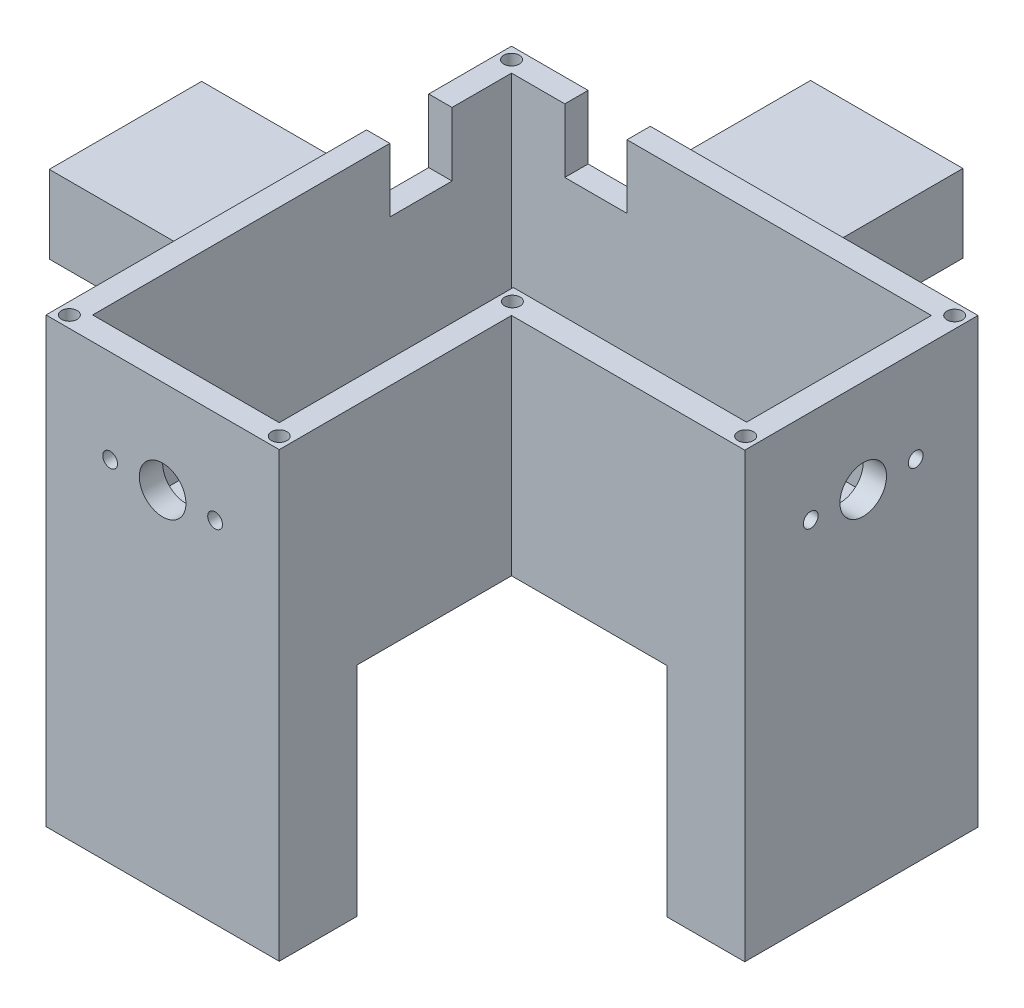
from build123d import *

# Parameters (mm, degrees)
ESQUISSE1_W              = 36.06
ESQUISSE1_H              = 19.6
ESQUISSE1_W_2            = 3
ESQUISSE1_H_2            = 3
ESQUISSE1_W_3            = 19.6
ESQUISSE1_H_3            = 24.34
ESQUISSE1_W_4            = 25.26
ESQUISSE1_H_4            = 36.26
BOSS_EXTRU_1_DEPTH       = 29.8
ESQUISSE2_W              = 19.6
ESQUISSE2_H              = 43.94
ESQUISSE2_W_2            = 25.26
ESQUISSE2_H_2            = 19.6
ENL_V_MAT_EXTRU_1_DEPTH  = 24.8
ESQUISSE3_W              = 36.06
ESQUISSE3_H              = 19.6
ESQUISSE3_W_2            = 19.6
ESQUISSE3_H_2            = 36.26
ENL_V_MAT_EXTRU_2_DEPTH  = 19.8
ESQUISSE6_W              = 56.587695841
ESQUISSE6_H              = 55.109837561
ENL_V_MAT_EXTRU_5_DEPTH  = 5
ESQUISSE7_W              = 4
ESQUISSE7_H              = 4
ENL_V_MAT_EXTRU_6_DEPTH  = 5
ESQUISSE8_W              = 4
ESQUISSE8_H              = 4
ENL_V_MAT_EXTRU_7_DEPTH  = 5
ENL_V_MAT_EXTRU_9_DEPTH  = 5
ENL_V_MAT_EXTRU_10_DEPTH = 5
ESQUISSE20_W             = 25.6
ESQUISSE20_H             = 10
BOSS_EXTRU_4_DEPTH       = 30.13
ESQUISSE21_W             = 10
ESQUISSE21_H             = 25.6
BOSS_EXTRU_5_DEPTH       = 30.13
ESQUISSE22_R             = 1.5
ENL_V_MAT_EXTRU_17_DEPTH = 5
ESQUISSE23_W             = 8
ESQUISSE23_H             = 10.8
BOSS_EXTRU_9_DEPTH       = 2.2
ESQUISSE28_W             = 10
ESQUISSE28_H             = 30.13
BOSS_EXTRU_10_DEPTH      = 2.2
ESQUISSE29_W             = 10
ESQUISSE29_H             = 30.13
BOSS_EXTRU_11_DEPTH      = 2.2
ESQUISSE30_W             = 3
ESQUISSE30_H             = 10
ESQUISSE30_W_2           = 8
ESQUISSE30_H_2           = 10.8
ESQUISSE30_W_3           = 10
ESQUISSE30_H_3           = 30.13
BOSS_EXTRU_12_DEPTH      = 2.2
ESQUISSE31_W             = 24.34
ESQUISSE31_H             = 19.8
ENL_V_MAT_EXTRU_18_DEPTH = 2.2
ESQUISSE32_W             = 23.06
ESQUISSE32_H             = 19.8
ENL_V_MAT_EXTRU_19_DEPTH = 2.2
ESQUISSE33_W             = 44.86
ESQUISSE33_H             = 19.8
ENL_V_MAT_EXTRU_20_DEPTH = 2.2
ESQUISSE34_W             = 46.14
ESQUISSE34_H             = 19.8
ENL_V_MAT_EXTRU_21_DEPTH = 2.2
ESQUISSE36_W             = 30
ESQUISSE36_H             = 54.93
BOSS_EXTRU_13_DEPTH      = 8.09
ESQUISSE37_W             = 30
ESQUISSE37_H             = 54.93
BOSS_EXTRU_14_DEPTH      = 8.09
ESQUISSE38_W             = 24
ESQUISSE38_H             = 19.8
ENL_V_MAT_EXTRU_24_DEPTH = 8.09
ESQUISSE39_W             = 24
ESQUISSE39_H             = 19.8
ENL_V_MAT_EXTRU_25_DEPTH = 8.09
ESQUISSE40_W             = 30
ESQUISSE40_H             = 30.13
ENL_V_MAT_EXTRU_26_DEPTH = 8.09
ESQUISSE41_W             = 30
ESQUISSE41_H             = 30.13
ENL_V_MAT_EXTRU_27_DEPTH = 8.09
ESQUISSE42_W             = 5.2
ESQUISSE42_H             = 10
BOSS_EXTRU_15_DEPTH      = 2.2
ESQUISSE43_W             = 3
ESQUISSE43_H             = 11
ESQUISSE43_W_2           = 8
ESQUISSE43_H_2           = 3
ESQUISSE43_W_3           = 39.15
ESQUISSE43_W_4           = 27.068190365
ESQUISSE43_H_3           = 2.93851698
ESQUISSE43_H_4           = 38.23
BOSS_EXTRU_16_DEPTH      = 4.2
ESQUISSE46_W             = 20.80469935
ESQUISSE46_H             = 8.510340819
BOSS_EXTRU_17_DEPTH      = 3
ESQUISSE47_W             = 0.068190365
ESQUISSE47_H             = 30.23
BOSS_EXTRU_18_DEPTH      = 4.2
ESQUISSE49_W             = 64.620174687
ESQUISSE49_H             = 80.514043406
ENL_V_MAT_EXTRU_30_DEPTH = 2.13
ESQUISSE50_W             = 10
ESQUISSE50_H             = 28
BOSS_EXTRU_19_DEPTH      = 1.15
ESQUISSE51_W             = 30.23
ESQUISSE51_H             = 24
ENL_V_MAT_EXTRU_31_DEPTH = 1.15
ESQUISSE52_W             = 38.23
ESQUISSE52_H             = 8.2
BOSS_EXTRU_20_DEPTH      = 1.15
ESQUISSE53_W             = 5.8
ESQUISSE53_H             = 8.2
ESQUISSE53_W_2           = 41.23
ESQUISSE53_W_3           = 10
ESQUISSE53_H_2           = 28
ENL_V_MAT_EXTRU_32_DEPTH = 1.15
ESQUISSE54_W             = 10
ESQUISSE54_H             = 28
BOSS_EXTRU_21_DEPTH      = 0.23
ESQUISSE55_W             = 39.15
ESQUISSE55_H             = 8.2
BOSS_EXTRU_22_DEPTH      = 0.23
ESQUISSE56_W             = 26.35
ESQUISSE56_H             = 10
ESQUISSE56_W_2           = 5.8
ESQUISSE56_H_2           = 8.2
ESQUISSE56_W_3           = 9.85
ESQUISSE56_W_4           = 4.05
ENL_V_MAT_EXTRU_33_DEPTH = 0.23
ESQUISSE57_R             = 3
ESQUISSE57_R_2           = 0.95
ENL_V_MAT_EXTRU_34_DEPTH = 7.23
ESQUISSE58_R             = 3
ESQUISSE58_R_2           = 0.95
ENL_V_MAT_EXTRU_35_DEPTH = 7.23
ESQUISSE59_W             = 10
ESQUISSE59_H             = 28
BOSS_EXTRU_23_DEPTH      = 0.12
ESQUISSE60_W             = 8
ESQUISSE60_H             = 15.8
BOSS_EXTRU_24_DEPTH      = 0.12
ESQUISSE61_W             = 32.15
ESQUISSE61_H             = 8.2
ESQUISSE61_W_2           = 26.35
ESQUISSE61_H_2           = 10
ESQUISSE61_W_3           = 9.85
ESQUISSE61_W_4           = 4.05
ENL_V_MAT_EXTRU_36_DEPTH = 0.12
ESQUISSE62_W             = 30
ESQUISSE62_H             = 24
ENL_V_MAT_EXTRU_37_DEPTH = 0.12
ENL_V_MAT_EXTRU_38_DEPTH = 5


with BuildPart() as part:
    # Esquisse1 → Boss.-Extru.1 (new body)
    with BuildSketch(Plane(origin=(0, 0, 0), x_dir=(1, 0, 0), z_dir=(0, 1, 0))):
        with Locations((-65.89, 9.8)):
            Rectangle(ESQUISSE1_W, ESQUISSE1_H)
        with Locations((-46.36, 9.8)):
            Rectangle(ESQUISSE1_W_2, ESQUISSE1_H)
        with Locations((-46.36, 21.1)):
            Rectangle(ESQUISSE1_W_2, ESQUISSE1_H_2)
        with Locations((-35.06, 21.1)):
            Rectangle(ESQUISSE1_W_3, ESQUISSE1_H_2)
        Polygon((0, 19.6), (0, 0), (-25.26, 0), (-25.26, -24.34), (-44.86, -24.34), (-44.86, 0), (-47.86, 0), (-47.86, -27.34), (-22.26, -27.34), (-22.26, -3), (3, -3), (3, 22.6), (-25.26, 22.6), (-25.26, 19.6), align=None)
        with Locations((-35.06, 9.8)):
            Rectangle(ESQUISSE1_W_3, ESQUISSE1_H)
        with Locations((-35.06, -12.17)):
            Rectangle(ESQUISSE1_W_3, ESQUISSE1_H_3)
        with Locations((-12.63, 9.8)):
            Rectangle(ESQUISSE1_W_4, ESQUISSE1_H)
        with Locations((-35.06, 40.73)):
            Rectangle(ESQUISSE1_W_3, ESQUISSE1_H_4)
    extrude(amount=BOSS_EXTRU_1_DEPTH)

    # Esquisse2 → Enlèv. mat.-Extru.1 (cut)
    with BuildSketch(Plane(origin=(0, 29.8, 0), x_dir=(1, 0, 0), z_dir=(0, 1, 0))):
        with Locations((-35.06, -2.37)):
            Rectangle(ESQUISSE2_W, ESQUISSE2_H)
        with Locations((-12.63, 9.8)):
            Rectangle(ESQUISSE2_W_2, ESQUISSE2_H_2)
    extrude(amount=-ENL_V_MAT_EXTRU_1_DEPTH, mode=Mode.SUBTRACT)

    # Esquisse3 → Enlèv. mat.-Extru.2 (cut)
    with BuildSketch(Plane(origin=(0, 29.8, 0), x_dir=(1, 0, 0), z_dir=(0, 1, 0))):
        with Locations((-65.89, 9.8)):
            Rectangle(ESQUISSE3_W, ESQUISSE3_H)
        with Locations((-35.06, 40.73)):
            Rectangle(ESQUISSE3_W_2, ESQUISSE3_H_2)
    extrude(amount=-ENL_V_MAT_EXTRU_2_DEPTH, mode=Mode.SUBTRACT)

    # Esquisse6 → Enlèv. mat.-Extru.5 (cut)
    with BuildSketch(Plane(origin=(-47.86, 29.8, 27.34), x_dir=(1, 0, 0), z_dir=(0, -1, 0))):
        with Locations((28.293847921, -22.38508122)):
            Rectangle(ESQUISSE6_W, ESQUISSE6_H)
    extrude(amount=ENL_V_MAT_EXTRU_5_DEPTH, mode=Mode.SUBTRACT)

    # Esquisse7 → Enlèv. mat.-Extru.6 (cut)
    with BuildSketch(Plane.ZY.offset(47.86)):
        with Locations((-11.8, 22.8)):
            Rectangle(ESQUISSE7_W, ESQUISSE7_H)
        with Locations((-7.8, 22.8)):
            Rectangle(ESQUISSE7_W, ESQUISSE7_H)
    extrude(amount=-ENL_V_MAT_EXTRU_6_DEPTH, mode=Mode.SUBTRACT)

    # Esquisse8 → Enlèv. mat.-Extru.7 (cut)
    with BuildSketch(Plane(origin=(0, 0, -22.6), x_dir=(-1, 0, 0), z_dir=(0, 0, -1))):
        with Locations((37.06, 22.8)):
            Rectangle(ESQUISSE8_W, ESQUISSE8_H)
        with Locations((33.06, 22.8)):
            Rectangle(ESQUISSE8_W, ESQUISSE8_H)
    extrude(amount=-ENL_V_MAT_EXTRU_7_DEPTH, mode=Mode.SUBTRACT)

    # Esquisse10 → Enlèv. mat.-Extru.9 (cut)
    with BuildSketch(Plane.ZY.offset(83.92)):
        with BuildLine():
            ThreePointArc((-3.4, 5), (-4.318983352, 6.38290262), (-5.949892874, 6.071319259))
            Line((-5.949892874, 6.071319259), (-3.850107126, 3.928680741))
            ThreePointArc((-3.850107126, 3.928680741), (-3.51709738, 4.418983352), (-3.4, 5))
        make_face()
        with BuildLine():
            Line((-3.850107126, 3.928680741), (-5.949892874, 6.071319259))
            ThreePointArc((-5.949892874, 6.071319259), (-5.971319259, 3.950107126), (-3.850107126, 3.928680741))
        make_face()
        with BuildLine():
            ThreePointArc((-13.2, 5), (-13.31709738, 5.581016648), (-13.650107126, 6.071319259))
            Line((-13.650107126, 6.071319259), (-15.749892874, 3.928680741))
            ThreePointArc((-15.749892874, 3.928680741), (-14.118983352, 3.61709738), (-13.2, 5))
        make_face()
        with BuildLine():
            Line((-15.749892874, 3.928680741), (-13.650107126, 6.071319259))
            ThreePointArc((-13.650107126, 6.071319259), (-15.771319259, 6.049892874), (-15.749892874, 3.928680741))
        make_face()
    extrude(amount=-ENL_V_MAT_EXTRU_9_DEPTH, mode=Mode.SUBTRACT)

    # Esquisse11 → Enlèv. mat.-Extru.10 (cut)
    with BuildSketch(Plane(origin=(0, 0, -58.86), x_dir=(-1, 0, 0), z_dir=(0, 0, -1))):
        with BuildLine():
            ThreePointArc((31.66, 5), (30.741016648, 6.38290262), (29.110107126, 6.071319259))
            Line((29.110107126, 6.071319259), (31.209892874, 3.928680741))
            ThreePointArc((31.209892874, 3.928680741), (31.54290262, 4.418983352), (31.66, 5))
        make_face()
        with BuildLine():
            Line((31.209892874, 3.928680741), (29.110107126, 6.071319259))
            ThreePointArc((29.110107126, 6.071319259), (29.088680741, 3.950107126), (31.209892874, 3.928680741))
        make_face()
        with BuildLine():
            ThreePointArc((41.009892874, 6.071319259), (38.888680741, 6.049892874), (38.910107126, 3.928680741))
            Line((38.910107126, 3.928680741), (41.009892874, 6.071319259))
        make_face()
        with BuildLine():
            Line((41.009892874, 6.071319259), (38.910107126, 3.928680741))
            ThreePointArc((38.910107126, 3.928680741), (40.541016648, 3.61709738), (41.46, 5))
            ThreePointArc((41.46, 5), (41.34290262, 5.581016648), (41.009892874, 6.071319259))
        make_face()
    extrude(amount=-ENL_V_MAT_EXTRU_10_DEPTH, mode=Mode.SUBTRACT)

    # Esquisse20 → Boss.-Extru.4 (add)
    with BuildSketch(Plane.XZ):
        with Locations((-35.06, 22.34)):
            Rectangle(ESQUISSE20_W, ESQUISSE20_H)
    extrude(amount=BOSS_EXTRU_4_DEPTH)

    # Esquisse21 → Boss.-Extru.5 (add)
    with BuildSketch(Plane.XZ):
        with Locations((-2, -9.8)):
            Rectangle(ESQUISSE21_W, ESQUISSE21_H)
    extrude(amount=BOSS_EXTRU_5_DEPTH)

    # Esquisse22 → Enlèv. mat.-Extru.17 (cut)
    with BuildSketch(Plane.XZ.offset(30.13)):
        with BuildLine():
            ThreePointArc((-2.923466063, -2.217963439), (-3.182036561, -4.323466063), (-1.076533937, -4.582036561))
            Line((-1.076533937, -4.582036561), (-2.923466063, -2.217963439))
        make_face()
        with BuildLine():
            Line((-2.923466063, -2.217963439), (-1.076533937, -4.582036561))
            ThreePointArc((-1.076533937, -4.582036561), (-0.651816204, -4.057571633), (-0.5, -3.4))
            ThreePointArc((-0.5, -3.4), (-1.342428367, -2.051816204), (-2.923466063, -2.217963439))
        make_face()
        with BuildLine():
            ThreePointArc((-27.16, 22.34), (-28.171663457, 23.758283265), (-29.842036561, 23.263466063))
            Line((-29.842036561, 23.263466063), (-27.477963439, 21.416533937))
            ThreePointArc((-27.477963439, 21.416533937), (-27.241716735, 21.851663457), (-27.16, 22.34))
        make_face()
        with BuildLine():
            Line((-27.477963439, 21.416533937), (-29.842036561, 23.263466063))
            ThreePointArc((-29.842036561, 23.263466063), (-29.583466063, 21.157963439), (-27.477963439, 21.416533937))
        make_face()
        with BuildLine():
            ThreePointArc((-39.96, 22.34), (-40.041716735, 22.828336543), (-40.277963439, 23.263466063))
            Line((-40.277963439, 23.263466063), (-42.642036561, 21.416533937))
            ThreePointArc((-42.642036561, 21.416533937), (-40.971663457, 20.921716735), (-39.96, 22.34))
        make_face()
        with BuildLine():
            Line((-42.642036561, 21.416533937), (-40.277963439, 23.263466063))
            ThreePointArc((-40.277963439, 23.263466063), (-42.383466063, 23.522036561), (-42.642036561, 21.416533937))
        make_face()
        with Locations(Location((-2, -16.2, 0), (0, 0, 270))):
            Circle(ESQUISSE22_R)
    extrude(amount=-ENL_V_MAT_EXTRU_17_DEPTH, mode=Mode.SUBTRACT)

    # Esquisse23 → Boss.-Extru.9 (add)
    with BuildSketch(Plane(origin=(0, 0, -22.6), x_dir=(-1, 0, 0), z_dir=(0, 0, -1))):
        Polygon((39.06, 20.8), (39.06, 10), (44.86, 10), (47.86, 10), (47.86, 24.8), (39.06, 24.8), align=None)
        with Locations((35.06, 15.4)):
            Rectangle(ESQUISSE23_W, ESQUISSE23_H)
        Polygon((25.26, 24.8), (7, 24.8), (7, 0), (25.26, 0), (25.26, 10), align=None)
        Polygon((31.06, 24.8), (25.26, 24.8), (25.26, 10), (31.06, 10), (31.06, 20.8), align=None)
        Polygon((7, 24.8), (-3, 24.8), (-3, -30.13), (7, -30.13), (7, 0), align=None)
    extrude(amount=BOSS_EXTRU_9_DEPTH)

    # Esquisse28 → Boss.-Extru.10 (add)
    with BuildSketch(Plane.XY.offset(3)):
        Polygon((3, 24.8), (-22.26, 24.8), (-22.26, 0), (-7, 0), (3, 0), align=None)
        with Locations((-2, -15.065)):
            Rectangle(ESQUISSE28_W, ESQUISSE28_H)
    extrude(amount=BOSS_EXTRU_10_DEPTH)

    # Esquisse29 → Boss.-Extru.11 (add)
    with BuildSketch(Plane(origin=(-22.26, 0, 0), x_dir=(0, 0, -1), z_dir=(1, 0, 0))):
        Polygon((-5.2, 24.8), (-27.34, 24.8), (-27.34, 0), (-17.34, 0), (-5.2, 0), align=None)
        with Locations((-22.34, -15.065)):
            Rectangle(ESQUISSE29_W, ESQUISSE29_H)
    extrude(amount=BOSS_EXTRU_11_DEPTH)

    # Esquisse30 → Boss.-Extru.12 (add)
    with BuildSketch(Plane.ZY.offset(47.86)):
        with Locations((-21.1, 5)):
            Rectangle(ESQUISSE30_W, ESQUISSE30_H)
        Polygon((-24.8, 24.8), (-24.8, 10), (-22.6, 10), (-19.6, 10), (-13.8, 10), (-13.8, 20.8), (-13.8, 24.8), align=None)
        with Locations((-9.8, 15.4)):
            Rectangle(ESQUISSE30_W_2, ESQUISSE30_H_2)
        Polygon((-5.8, 20.8), (-5.8, 10), (0, 10), (27.34, 10), (27.34, 24.8), (-5.8, 24.8), align=None)
        Polygon((27.34, 10), (0, 10), (0, 0), (17.34, 0), (27.34, 0), align=None)
        with Locations((22.34, -15.065)):
            Rectangle(ESQUISSE30_W_3, ESQUISSE30_H_3)
    extrude(amount=BOSS_EXTRU_12_DEPTH)

    # Esquisse31 → Enlèv. mat.-Extru.18 (cut)
    with BuildSketch(Plane.ZY.offset(25.26)):
        with Locations((12.17, 14.9)):
            Rectangle(ESQUISSE31_W, ESQUISSE31_H)
    extrude(amount=-ENL_V_MAT_EXTRU_18_DEPTH, mode=Mode.SUBTRACT)

    # Esquisse32 → Enlèv. mat.-Extru.19 (cut)
    with BuildSketch(Plane(origin=(0, 0, 0), x_dir=(-1, 0, 0), z_dir=(0, 0, -1))):
        with Locations((11.53, 14.9)):
            Rectangle(ESQUISSE32_W, ESQUISSE32_H)
    extrude(amount=-ENL_V_MAT_EXTRU_19_DEPTH, mode=Mode.SUBTRACT)

    # Esquisse33 → Enlèv. mat.-Extru.20 (cut)
    with BuildSketch(Plane.XY.offset(-19.6)):
        with Locations((-22.43, 14.9)):
            Rectangle(ESQUISSE33_W, ESQUISSE33_H)
    extrude(amount=-ENL_V_MAT_EXTRU_20_DEPTH, mode=Mode.SUBTRACT)

    # Esquisse34 → Enlèv. mat.-Extru.21 (cut)
    with BuildSketch(Plane(origin=(-44.86, 0, 0), x_dir=(0, 0, -1), z_dir=(1, 0, 0))):
        with Locations((-1.27, 14.9)):
            Rectangle(ESQUISSE34_W, ESQUISSE34_H)
    extrude(amount=-ENL_V_MAT_EXTRU_21_DEPTH, mode=Mode.SUBTRACT)

    # Esquisse36 → Boss.-Extru.13 (add)
    with BuildSketch(Plane.XY.offset(27.34)):
        with Locations((-35.06, -2.665)):
            Rectangle(ESQUISSE36_W, ESQUISSE36_H)
    extrude(amount=BOSS_EXTRU_13_DEPTH)

    # Esquisse37 → Boss.-Extru.14 (add)
    with BuildSketch(Plane(origin=(3, 0, 0), x_dir=(0, 0, -1), z_dir=(1, 0, 0))):
        with Locations((9.8, -2.665)):
            Rectangle(ESQUISSE37_W, ESQUISSE37_H)
    extrude(amount=BOSS_EXTRU_14_DEPTH)

    # Esquisse38 → Enlèv. mat.-Extru.24 (cut)
    with BuildSketch(Plane(origin=(0, 0, 24.34), x_dir=(-1, 0, 0), z_dir=(0, 0, -1))):
        with Locations((35.06, 14.9)):
            Rectangle(ESQUISSE38_W, ESQUISSE38_H)
    extrude(amount=-ENL_V_MAT_EXTRU_24_DEPTH, mode=Mode.SUBTRACT)

    # Esquisse39 → Enlèv. mat.-Extru.25 (cut)
    with BuildSketch(Plane.ZY):
        with Locations((-9.8, 14.9)):
            Rectangle(ESQUISSE39_W, ESQUISSE39_H)
    extrude(amount=-ENL_V_MAT_EXTRU_25_DEPTH, mode=Mode.SUBTRACT)

    # Esquisse40 → Enlèv. mat.-Extru.26 (cut)
    with BuildSketch(Plane.ZY.offset(7)):
        with Locations((-9.8, -15.065)):
            Rectangle(ESQUISSE40_W, ESQUISSE40_H)
    extrude(amount=-ENL_V_MAT_EXTRU_26_DEPTH, mode=Mode.SUBTRACT)

    # Esquisse41 → Enlèv. mat.-Extru.27 (cut)
    with BuildSketch(Plane(origin=(0, 0, 17.34), x_dir=(-1, 0, 0), z_dir=(0, 0, -1))):
        with Locations((35.06, -15.065)):
            Rectangle(ESQUISSE41_W, ESQUISSE41_H)
    extrude(amount=-ENL_V_MAT_EXTRU_27_DEPTH, mode=Mode.SUBTRACT)

    # Esquisse42 → Boss.-Extru.15 (add)
    with BuildSketch(Plane(origin=(0, 0, -22.6), x_dir=(-1, 0, 0), z_dir=(0, 0, -1))):
        with Locations((47.46, 5)):
            Rectangle(ESQUISSE42_W, ESQUISSE42_H)
    extrude(amount=BOSS_EXTRU_15_DEPTH)

    # Esquisse43 → Boss.-Extru.16 (add)
    with BuildSketch(Plane(origin=(0, 24.8, 0), x_dir=(1, 0, 0), z_dir=(0, 1, 0))):
        with Locations((-48.56, 19.3)):
            Rectangle(ESQUISSE43_W, ESQUISSE43_H)
        with Locations((-43.06, 23.3)):
            Rectangle(ESQUISSE43_W_2, ESQUISSE43_H_2)
        with Locations((-11.485, 23.3)):
            Rectangle(ESQUISSE43_W_3, ESQUISSE43_H_2)
        Polygon((11.09, 24.8), (8.09, 24.8), (8.09, 21.8), (8.09, -2.2), (8.09, -5.2), (11.09, -5.2), align=None)
        Polygon((8.09, -5.2), (8.09, -2.2), (-22.991809635, -2.2), (-22.991809635, -5.2), (-20.06, -5.2), align=None)
        Polygon((-20.06, -35.43), (-20.06, -5.2), (-22.991809635, -5.2), (-22.991809635, -32.49148302), (-22.991809635, -35.43), align=None)
        with Locations((-36.525904818, -33.96074151)):
            Rectangle(ESQUISSE43_W_4, ESQUISSE43_H_3)
        with Locations((-48.56, -13.315)):
            Rectangle(ESQUISSE43_W, ESQUISSE43_H_4)
    extrude(amount=BOSS_EXTRU_16_DEPTH)

    # Esquisse46 → Boss.-Extru.17 (add)
    with BuildSketch(Plane.ZY.offset(50.06)):
        with Locations((-9.490469772, 16.17879145)):
            Rectangle(ESQUISSE46_W, ESQUISSE46_H)
    extrude(amount=-BOSS_EXTRU_17_DEPTH)

    # Esquisse47 → Boss.-Extru.18 (add)
    with BuildSketch(Plane(origin=(0, 24.8, 0), x_dir=(1, 0, 0), z_dir=(0, 1, 0))):
        with Locations((-23.025904818, -17.315)):
            Rectangle(ESQUISSE47_W, ESQUISSE47_H)
        Polygon((-47.06, -32.43), (-50.06, -32.43), (-50.06, -32.49148302), (-22.991809635, -32.49148302), (-22.991809635, -32.43), (-23.06, -32.43), align=None)
    extrude(amount=BOSS_EXTRU_18_DEPTH)

    # Esquisse49 → Enlèv. mat.-Extru.30 (cut)
    with BuildSketch(Plane.XZ.offset(30.13)):
        with Locations((-17.749912657, -4.827021703)):
            Rectangle(ESQUISSE49_W, ESQUISSE49_H)
    extrude(amount=-ENL_V_MAT_EXTRU_30_DEPTH, mode=Mode.SUBTRACT)

    # Esquisse50 → Boss.-Extru.19 (add)
    with BuildSketch(Plane(origin=(-20.06, 0, 0), x_dir=(0, 0, -1), z_dir=(1, 0, 0))):
        Polygon((-5.2, 29), (-35.43, 29), (-35.43, 0), (-25.43, 0), (-5.2, 0), align=None)
        with Locations((-30.43, -14)):
            Rectangle(ESQUISSE50_W, ESQUISSE50_H)
    extrude(amount=BOSS_EXTRU_19_DEPTH)

    # Esquisse51 → Enlèv. mat.-Extru.31 (cut)
    with BuildSketch(Plane.ZY.offset(23.06)):
        with Locations((17.315, 17)):
            Rectangle(ESQUISSE51_W, ESQUISSE51_H)
    extrude(amount=-ENL_V_MAT_EXTRU_31_DEPTH, mode=Mode.SUBTRACT)

    # Esquisse52 → Boss.-Extru.20 (add)
    with BuildSketch(Plane(origin=(-47.06, 0, 0), x_dir=(0, 0, -1), z_dir=(1, 0, 0))):
        with Locations((-13.315, 24.9)):
            Rectangle(ESQUISSE52_W, ESQUISSE52_H)
        Polygon((5.8, 20.8), (-32.43, 20.8), (-32.43, 5), (13.8, 5), (13.8, 20.8), align=None)
        Polygon((13.8, 29), (13.8, 20.8), (13.8, 5), (21.8, 5), (21.8, 29), align=None)
    extrude(amount=BOSS_EXTRU_20_DEPTH)

    # Esquisse53 → Enlèv. mat.-Extru.32 (cut)
    with BuildSketch(Plane.ZY.offset(50.06)):
        Polygon((-24.8, 0), (-19.6, 0), (-19.6, 10), (-19.6, 20.8), (-19.6, 29), (-24.8, 29), align=None)
        with Locations((-16.7, 24.9)):
            Rectangle(ESQUISSE53_W, ESQUISSE53_H)
        Polygon((-19.6, 20.8), (-19.6, 10), (0, 10), (35.43, 10), (35.43, 20.8), (-5.8, 20.8), (-13.8, 20.8), align=None)
        with Locations((14.815, 24.9)):
            Rectangle(ESQUISSE53_W_2, ESQUISSE53_H)
        Polygon((35.43, 10), (0, 10), (0, 0), (25.43, 0), (35.43, 0), align=None)
        with Locations((30.43, -14)):
            Rectangle(ESQUISSE53_W_3, ESQUISSE53_H_2)
    extrude(amount=-ENL_V_MAT_EXTRU_32_DEPTH, mode=Mode.SUBTRACT)

    # Esquisse54 → Boss.-Extru.21 (add)
    with BuildSketch(Plane.XY.offset(5.2)):
        Polygon((11.09, 29), (-18.91, 29), (-18.91, 0), (1.09, 0), (11.09, 0), align=None)
        with Locations((6.09, -14)):
            Rectangle(ESQUISSE54_W, ESQUISSE54_H)
    extrude(amount=BOSS_EXTRU_21_DEPTH)

    # Esquisse55 → Boss.-Extru.22 (add)
    with BuildSketch(Plane.XY.offset(-21.8)):
        Polygon((-45.91, 29), (-45.91, 5), (-39.06, 5), (-39.06, 20.8), (-39.06, 29), align=None)
        Polygon((-39.06, 20.8), (-39.06, 5), (8.09, 5), (8.09, 20.8), (-31.06, 20.8), align=None)
        with Locations((-11.485, 24.9)):
            Rectangle(ESQUISSE55_W, ESQUISSE55_H)
    extrude(amount=BOSS_EXTRU_22_DEPTH)

    # Esquisse56 → Enlèv. mat.-Extru.33 (cut)
    with BuildSketch(Plane(origin=(0, 0, -24.8), x_dir=(-1, 0, 0), z_dir=(0, 0, -1))):
        Polygon((-11.09, -28), (-1.09, -28), (-1.09, 0), (-1.09, 10), (-1.09, 29), (-11.09, 29), align=None)
        with Locations((12.085, 5)):
            Rectangle(ESQUISSE56_W, ESQUISSE56_H)
        Polygon((-1.09, 29), (-1.09, 10), (25.26, 10), (25.26, 20.8), (25.26, 29), align=None)
        Polygon((25.26, 20.8), (25.26, 10), (44.86, 10), (48.91, 10), (48.91, 20.8), (39.06, 20.8), (31.06, 20.8), align=None)
        with Locations((28.16, 24.9)):
            Rectangle(ESQUISSE56_W_2, ESQUISSE56_H_2)
        with Locations((43.985, 24.9)):
            Rectangle(ESQUISSE56_W_3, ESQUISSE56_H_2)
        with Locations((46.885, 5)):
            Rectangle(ESQUISSE56_W_4, ESQUISSE56_H)
    extrude(amount=-ENL_V_MAT_EXTRU_33_DEPTH, mode=Mode.SUBTRACT)

    # Esquisse57 → Enlèv. mat.-Extru.34 (cut)
    with BuildSketch(Plane.ZY.offset(-8.09)):
        with Locations((-9.685, 17)):
            Circle(ESQUISSE57_R)
        with Locations((-16.435, 17)):
            Circle(ESQUISSE57_R_2)
        with Locations((-2.935, 17)):
            Circle(ESQUISSE57_R_2)
    extrude(amount=-ENL_V_MAT_EXTRU_34_DEPTH, mode=Mode.SUBTRACT)

    # Esquisse58 → Enlèv. mat.-Extru.35 (cut)
    with BuildSketch(Plane(origin=(0, 0, 32.43), x_dir=(-1, 0, 0), z_dir=(0, 0, -1))):
        with Locations((33.91, 17)):
            Circle(ESQUISSE58_R)
        with Locations((27.16, 17)):
            Circle(ESQUISSE58_R_2)
        with Locations((40.66, 17)):
            Circle(ESQUISSE58_R_2)
    extrude(amount=-ENL_V_MAT_EXTRU_35_DEPTH, mode=Mode.SUBTRACT)

    # Esquisse59 → Boss.-Extru.23 (add)
    with BuildSketch(Plane.XY.offset(5.43)):
        Polygon((11.09, 29), (-18.91, 29), (-18.91, 0), (1.09, 0), (11.09, 0), align=None)
        with Locations((6.09, -14)):
            Rectangle(ESQUISSE59_W, ESQUISSE59_H)
    extrude(amount=BOSS_EXTRU_23_DEPTH)

    # Esquisse60 → Boss.-Extru.24 (add)
    with BuildSketch(Plane.XY.offset(-21.57)):
        Polygon((-39.06, 5), (-39.06, 20.8), (-39.06, 29), (-45.91, 29), (-45.91, 5), align=None)
        with Locations((-35.06, 12.9)):
            Rectangle(ESQUISSE60_W, ESQUISSE60_H)
        Polygon((8.09, 29), (-31.06, 29), (-31.06, 20.8), (-31.06, 5), (8.09, 5), align=None)
    extrude(amount=BOSS_EXTRU_24_DEPTH)

    # Esquisse61 → Enlèv. mat.-Extru.36 (cut)
    with BuildSketch(Plane(origin=(0, 0, -24.57), x_dir=(-1, 0, 0), z_dir=(0, 0, -1))):
        Polygon((-11.09, -28), (-1.09, -28), (-1.09, 0), (-1.09, 10), (-1.09, 20.8), (-1.09, 29), (-11.09, 29), align=None)
        with Locations((14.985, 24.9)):
            Rectangle(ESQUISSE61_W, ESQUISSE61_H)
        Polygon((-1.09, 20.8), (-1.09, 10), (25.26, 10), (44.86, 10), (48.91, 10), (48.91, 20.8), (39.06, 20.8), (31.06, 20.8), align=None)
        with Locations((12.085, 5)):
            Rectangle(ESQUISSE61_W_2, ESQUISSE61_H_2)
        with Locations((43.985, 24.9)):
            Rectangle(ESQUISSE61_W_3, ESQUISSE61_H)
        with Locations((46.885, 5)):
            Rectangle(ESQUISSE61_W_4, ESQUISSE61_H_2)
    extrude(amount=-ENL_V_MAT_EXTRU_36_DEPTH, mode=Mode.SUBTRACT)

    # Esquisse62 → Enlèv. mat.-Extru.37 (cut)
    with BuildSketch(Plane(origin=(8.09, 29, 2.2), x_dir=(1, 0, 0), z_dir=(0, 0, 1))):
        with Locations((-15, -12)):
            Rectangle(ESQUISSE62_W, ESQUISSE62_H)
    extrude(amount=ENL_V_MAT_EXTRU_37_DEPTH, mode=Mode.SUBTRACT)

    # Esquisse64 → Enlèv. mat.-Extru.38 (cut)
    with BuildSketch(Plane(origin=(0, 29, 0), x_dir=(1, 0, 0), z_dir=(0, 1, 0))):
        with BuildLine():
            ThreePointArc((-46.41, -33.93), (-46.486120467, -33.547316568), (-46.702893219, -33.222893219))
            Line((-46.702893219, -33.222893219), (-48.117106781, -34.637106781))
            ThreePointArc((-48.117106781, -34.637106781), (-47.027316568, -34.853879533), (-46.41, -33.93))
        make_face()
        with BuildLine():
            Line((-48.117106781, -34.637106781), (-46.702893219, -33.222893219))
            ThreePointArc((-46.702893219, -33.222893219), (-48.117106781, -33.222893219), (-48.117106781, -34.637106781))
        make_face()
        with BuildLine():
            ThreePointArc((-21.117106781, -33.222893219), (-21.117106781, -34.637106781), (-19.702893219, -34.637106781))
            Line((-19.702893219, -34.637106781), (-21.117106781, -33.222893219))
        make_face()
        with BuildLine():
            Line((-21.117106781, -33.222893219), (-19.702893219, -34.637106781))
            ThreePointArc((-19.702893219, -34.637106781), (-19.486120467, -34.312683432), (-19.41, -33.93))
            ThreePointArc((-19.41, -33.93), (-20.027316568, -33.006120467), (-21.117106781, -33.222893219))
        make_face()
        with BuildLine():
            ThreePointArc((-21.090538104, -3.202287308), (-21.142712692, -4.615538104), (-19.729461896, -4.667712692))
            Line((-19.729461896, -4.667712692), (-21.090538104, -3.202287308))
        make_face()
        with BuildLine():
            Line((-21.090538104, -3.202287308), (-19.729461896, -4.667712692))
            ThreePointArc((-19.729461896, -4.667712692), (-19.493338093, -4.334663543), (-19.41, -3.935))
            ThreePointArc((-19.41, -3.935), (-20.010336457, -3.018338093), (-21.090538104, -3.202287308))
        make_face()
        with BuildLine():
            ThreePointArc((8.909461896, -3.202287308), (8.857287308, -4.615538104), (10.270538104, -4.667712692))
            Line((10.270538104, -4.667712692), (8.909461896, -3.202287308))
        make_face()
        with BuildLine():
            Line((8.909461896, -3.202287308), (10.270538104, -4.667712692))
            ThreePointArc((10.270538104, -4.667712692), (10.506661907, -4.334663543), (10.59, -3.935))
            ThreePointArc((10.59, -3.935), (9.989663543, -3.018338093), (8.909461896, -3.202287308))
        make_face()
        with BuildLine():
            ThreePointArc((10.59, 22.95), (10.513879533, 23.332683432), (10.297106781, 23.657106781))
            Line((10.297106781, 23.657106781), (8.882893219, 22.242893219))
            ThreePointArc((8.882893219, 22.242893219), (9.972683432, 22.026120467), (10.59, 22.95))
        make_face()
        with BuildLine():
            Line((8.882893219, 22.242893219), (10.297106781, 23.657106781))
            ThreePointArc((10.297106781, 23.657106781), (8.882893219, 23.657106781), (8.882893219, 22.242893219))
        make_face()
        with BuildLine():
            ThreePointArc((-48.117106781, 23.657106781), (-48.117106781, 22.242893219), (-46.702893219, 22.242893219))
            Line((-46.702893219, 22.242893219), (-48.117106781, 23.657106781))
        make_face()
        with BuildLine():
            Line((-48.117106781, 23.657106781), (-46.702893219, 22.242893219))
            ThreePointArc((-46.702893219, 22.242893219), (-46.486120467, 22.567316568), (-46.41, 22.95))
            ThreePointArc((-46.41, 22.95), (-47.027316568, 23.873879533), (-48.117106781, 23.657106781))
        make_face()
    extrude(amount=-ENL_V_MAT_EXTRU_38_DEPTH, mode=Mode.SUBTRACT)


solid = part.part
